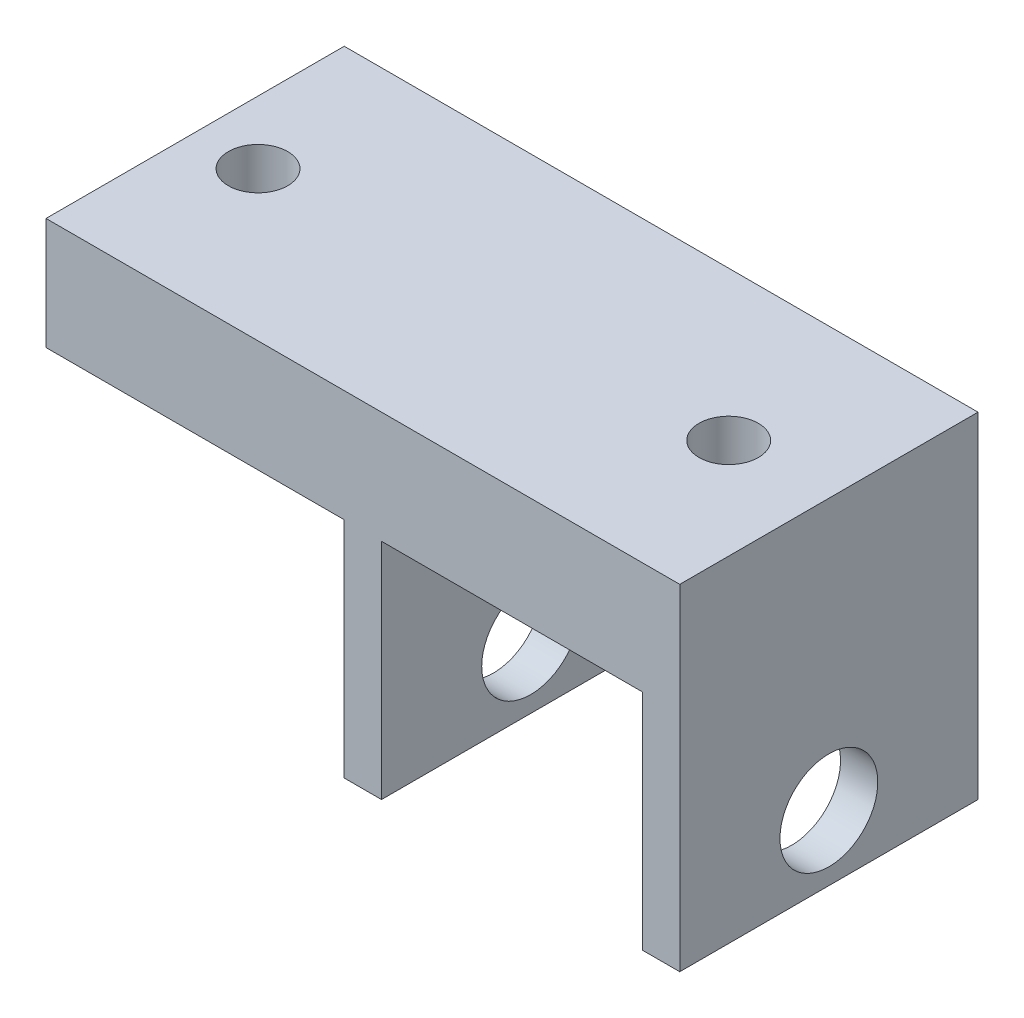
from build123d import *

# Parameters (mm, degrees)
BOSS_EXTRUDE1_DEPTH        = 25.4
SKETCH2_R                  = 4.1671875
CUT_EXTRUDE1_DEPTH         = 43.715256349
F_8_0_199_DIAMETER_HOLE1_D = 5.0546


with BuildPart() as part:
    # Sketch1 → Boss-Extrude1 (new body)
    with BuildSketch(Plane.XY):
        Polygon((-14.2875, 9.525), (-14.2875, -9.525), (-11.1125, -9.525), (-11.1125, 9.525), (11.1125, 9.525), (11.1125, -9.525), (14.2875, -9.525), (14.2875, 19.05), (-39.6875, 19.05), (-39.6875, 9.525), align=None)
    extrude(amount=BOSS_EXTRUDE1_DEPTH)

    # Sketch2 → Cut-Extrude1 (cut, through all)
    with BuildSketch(Plane.ZY.offset(14.2875)):
        with Locations((12.7, -3.96875)):
            Circle(SKETCH2_R)
    extrude(amount=-CUT_EXTRUDE1_DEPTH, mode=Mode.SUBTRACT)

    # #8 (0.199) Diameter Hole1 (through all)
    with Locations(Plane(origin=(0, 19.05, 0), x_dir=(1, 0, 0), z_dir=(0, 1, 0))):
        with Locations((-34.3296875, -12.7), (5.7546875, -12.7)):
            Hole(F_8_0_199_DIAMETER_HOLE1_D / 2)


solid = part.part
